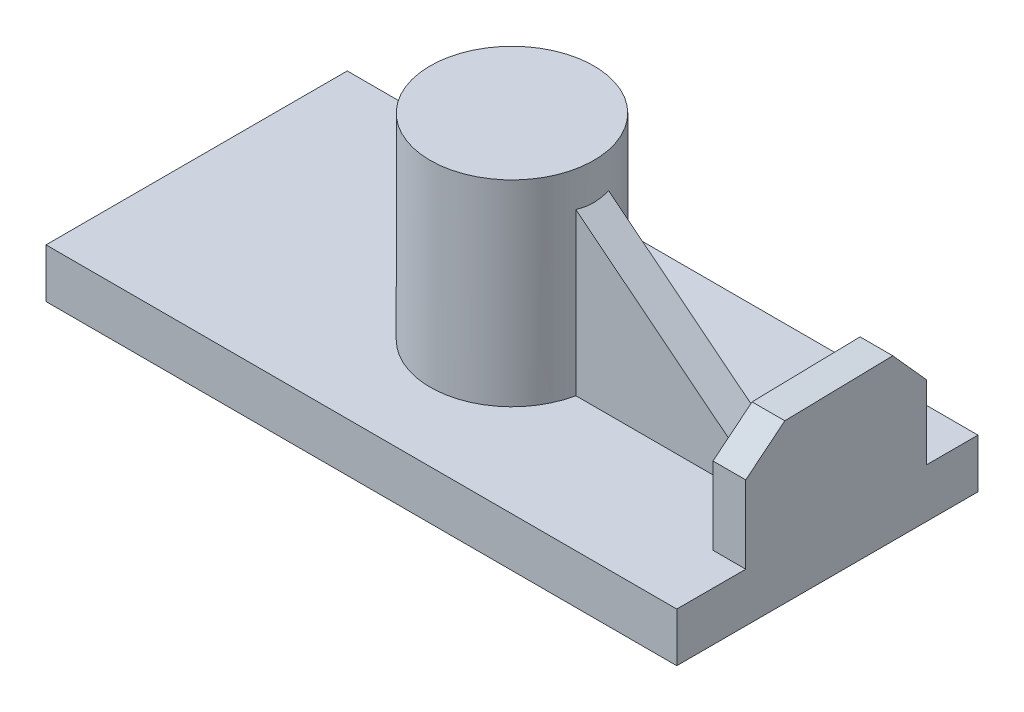
from build123d import *

# Parameters (mm, degrees)
ESQUISSE1_W        = 192.615231554
ESQUISSE1_H        = 91.988888612
BOSS_EXTRU_1_DEPTH = 15
ESQUISSE3_R        = 25
BOSS_EXTRU_2_DEPTH = 60
BOSS_EXTRU_3_DEPTH = 10
NERVURE1_REACH     = 132.444
ESQUISSE5_WALL_W   = 340.670663134
ESQUISSE5_WALL_H   = 10


with BuildPart() as part:
    # Esquisse1 → Boss.-Extru.1 (new body)
    with BuildSketch(Plane(origin=(0, 0, 0), x_dir=(1, 0, 0), z_dir=(0, 1, 0))):
        Rectangle(ESQUISSE1_W, ESQUISSE1_H)
    extrude(amount=BOSS_EXTRU_1_DEPTH)

    # Esquisse3 → Boss.-Extru.2 (add)
    with BuildSketch(Plane(origin=(0, 15, 0), x_dir=(1, 0, 0), z_dir=(0, 1, 0))):
        with Locations(Location((0, 0, 0), (0, 0, 270))):
            Circle(ESQUISSE3_R)
    extrude(amount=BOSS_EXTRU_2_DEPTH)

    # Esquisse4 → Boss.-Extru.3 (add)
    with BuildSketch(Plane(origin=(96.307615777, 0, 0), x_dir=(0, 0, -1), z_dir=(1, 0, 0))):
        Polygon((-24.930682443, 15), (30.224142476, 15), (30.224142476, 37.550884027), (19.979617808, 48.99012657), (-12.997025488, 48.281884538), (-24.930682443, 38.617807381), align=None)
    extrude(amount=-BOSS_EXTRU_3_DEPTH)

    # Esquisse5 wall → Nervure1 (add, up to next)
    with BuildSketch(Plane(origin=(55.88995931, 39.234258268, 0), x_dir=(0.782119847954, -0.623128031336, 0), z_dir=(0.623128031336, 0.782119847954, 0)), mode=Mode.PRIVATE) as nervure1_sk1:
        Rectangle(ESQUISSE5_WALL_W, ESQUISSE5_WALL_H)
    nervure1_tool1 = extrude(nervure1_sk1.sketch, amount=-NERVURE1_REACH, mode=Mode.PRIVATE) - part.part
    add(nervure1_tool1.solids().sort_by_distance((55.88995931, 39.234258268, 0))[0])


solid = part.part
